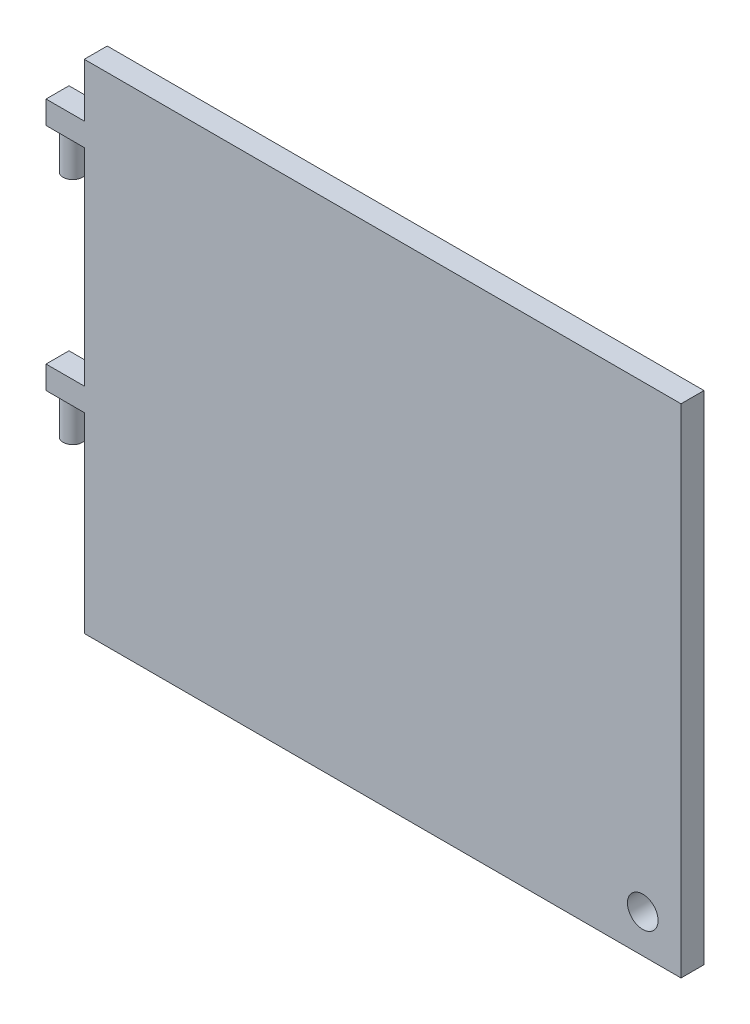
from build123d import *

# Parameters (mm, degrees)
IZIM1_W                     = 78
IZIM1_H                     = 65
Y_KSEKLIK_EKSTR_ZYON1_DEPTH = 3
IZIM2_W                     = 3
IZIM2_H                     = 3
Y_KSEKLIK_EKSTR_ZYON2_DEPTH = 5
IZIM4_R                     = 1.25
Y_KSEKLIK_EKSTR_ZYON3_DEPTH = 5
IZIM5_R                     = 1.25
Y_KSEKLIK_EKSTR_ZYON4_DEPTH = 5
IZIM6_R                     = 2
KES_EKSTR_ZYON2_DEPTH       = 10


with BuildPart() as part:
    # Çizim1 → Yükseklik-Ekstrüzyon1 (new body)
    with BuildSketch(Plane.XY):
        with Locations((39, 32.5)):
            Rectangle(IZIM1_W, IZIM1_H)
    extrude(amount=Y_KSEKLIK_EKSTR_ZYON1_DEPTH)

    # Çizim2 → Yükseklik-Ekstrüzyon2 (add)
    with BuildSketch(Plane.ZY):
        with Locations((1.5, 56.5)):
            Rectangle(IZIM2_W, IZIM2_H)
        with Locations((1.5, 26.5)):
            Rectangle(IZIM2_W, IZIM2_H)
    extrude(amount=Y_KSEKLIK_EKSTR_ZYON2_DEPTH)

    # Çizim4 → Yükseklik-Ekstrüzyon3 (add)
    with BuildSketch(Plane.XZ.offset(-55)):
        with Locations(Location((-3, 1.5, 0), (0, 0, 90))):
            Circle(IZIM4_R)
    extrude(amount=Y_KSEKLIK_EKSTR_ZYON3_DEPTH)

    # Çizim5 → Yükseklik-Ekstrüzyon4 (add)
    with BuildSketch(Plane.XZ.offset(-25)):
        with Locations(Location((-3, 1.5, 0), (0, 0, 90))):
            Circle(IZIM5_R)
    extrude(amount=Y_KSEKLIK_EKSTR_ZYON4_DEPTH)

    # Çizim6 → Kes-Ekstrüzyon2 (cut)
    with BuildSketch(Plane.XY.offset(3)):
        with Locations((73, 5)):
            Circle(IZIM6_R)
    extrude(amount=-KES_EKSTR_ZYON2_DEPTH, mode=Mode.SUBTRACT)


solid = part.part
